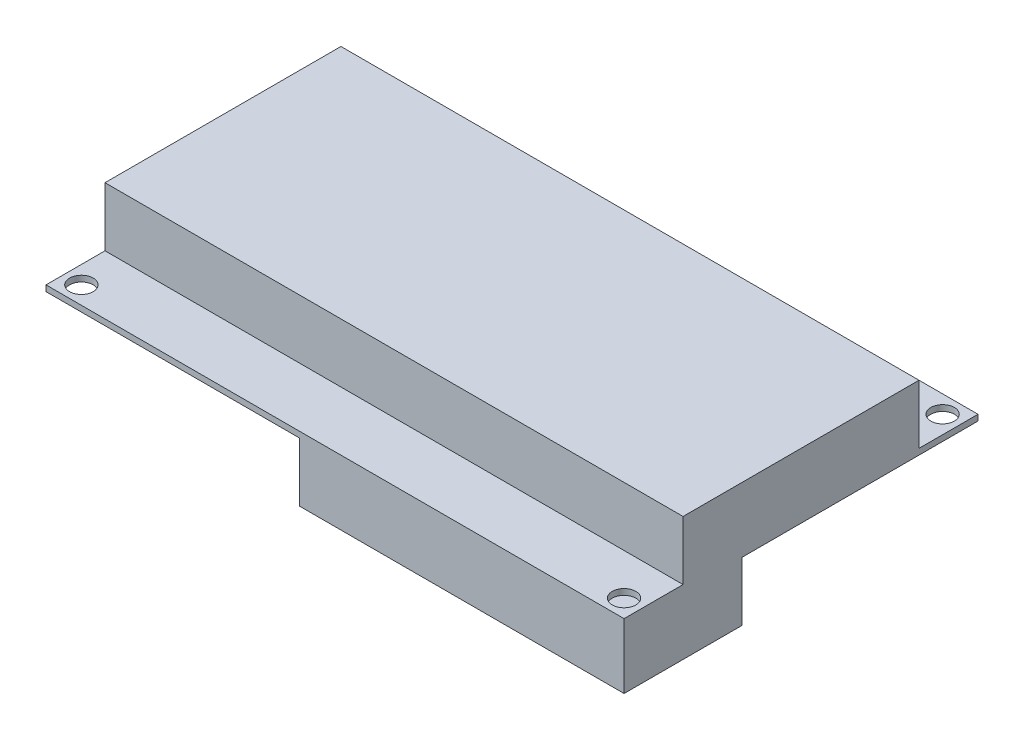
from build123d import *

# Parameters (mm, degrees)
SKETCH2_W               = 98
SKETCH2_H               = 60
BOSS_EXTRUDE1_DEPTH     = 1
SKETCH3_W               = 98
SKETCH3_H               = 40
BOSS_EXTRUDE2_DEPTH     = 10
SKETCH4_R               = 2
CUT_EXTRUDE1_DEPTH      = 10
MIRROR2_COPY_1_SKETCH_R = 2
MIRROR2_COPY_1_DEPTH    = 10
SKETCH5_W               = 55
SKETCH5_H               = 20
BOSS_EXTRUDE3_DEPTH     = 10


with BuildPart() as part:
    # Sketch2 → Boss-Extrude1 (new body)
    with BuildSketch(Plane(origin=(0, 0, 0), x_dir=(1, 0, 0), z_dir=(0, 1, 0))):
        Rectangle(SKETCH2_W, SKETCH2_H)
    extrude(amount=BOSS_EXTRUDE1_DEPTH)

    # Sketch3 → Boss-Extrude2 (add)
    with BuildSketch(Plane(origin=(0, 1, 0), x_dir=(1, 0, 0), z_dir=(0, 1, 0))):
        Rectangle(SKETCH3_W, SKETCH3_H)
    extrude(amount=BOSS_EXTRUDE2_DEPTH)

    # Sketch4 → Cut-Extrude1 (cut)
    with BuildSketch(Plane(origin=(0, 1, 0), x_dir=(1, 0, 0), z_dir=(0, 1, 0))):
        with Locations(Location((-46, 27, 0), (0, 0, 270))):
            Circle(SKETCH4_R)
    cut_extrude1 = extrude(amount=-CUT_EXTRUDE1_DEPTH, mode=Mode.SUBTRACT)

    # Mirror1: Cut-Extrude1 across plane
    add(cut_extrude1.mirror(Plane.XY), mode=Mode.SUBTRACT)

    # Mirror2: Cut-Extrude1 across plane
    add(cut_extrude1.mirror(Plane(origin=(0, 0, 0), x_dir=(0, 0, 1), z_dir=(1, 0, 0))), mode=Mode.SUBTRACT)

    # Mirror2 copy 1 sketch → Mirror2 copy 1 (cut)
    with BuildSketch(Plane(origin=(0, 1, 0), x_dir=(-1, 0, 0), z_dir=(0, 1, 0))):
        with Locations(Location((-46, 27, 0), (0, 0, 270))):
            Circle(MIRROR2_COPY_1_SKETCH_R)
    extrude(amount=-MIRROR2_COPY_1_DEPTH, mode=Mode.SUBTRACT)

    # Sketch5 → Boss-Extrude3 (add)
    with BuildSketch(Plane.XZ):
        with Locations((21.5, 20)):
            Rectangle(SKETCH5_W, SKETCH5_H)
    extrude(amount=BOSS_EXTRUDE3_DEPTH)


solid = part.part
